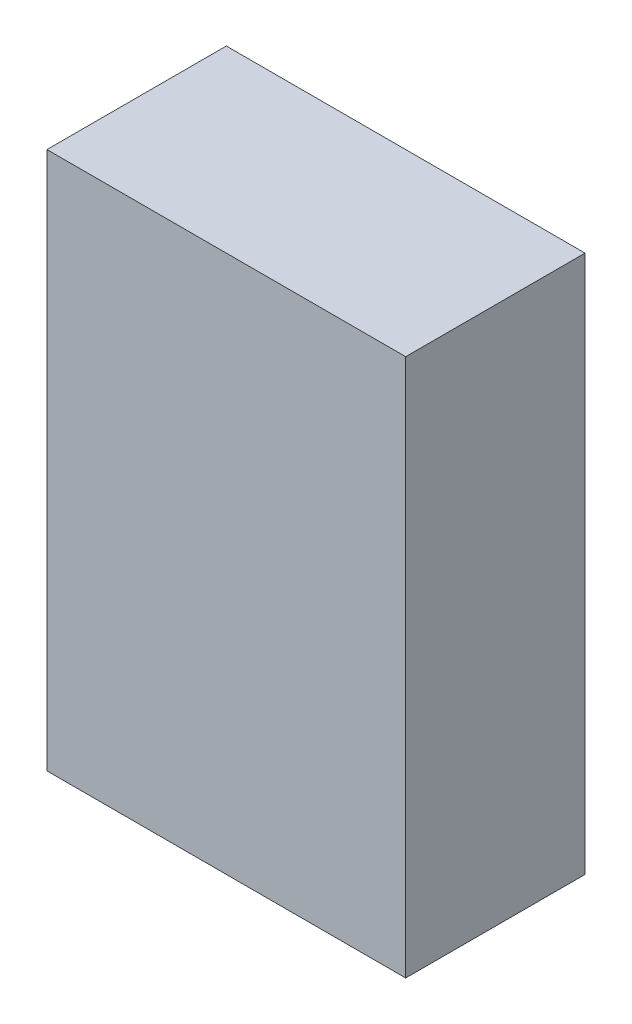
from build123d import *

# Parameters (mm, degrees)
SKETCH1_W           = 20
SKETCH1_H           = 30
BOSS_EXTRUDE1_DEPTH = 10


with BuildPart() as part:
    # Sketch1 → Boss-Extrude1 (new body)
    with BuildSketch(Plane.XY):
        Rectangle(SKETCH1_W, SKETCH1_H)
    extrude(amount=BOSS_EXTRUDE1_DEPTH)


solid = part.part
